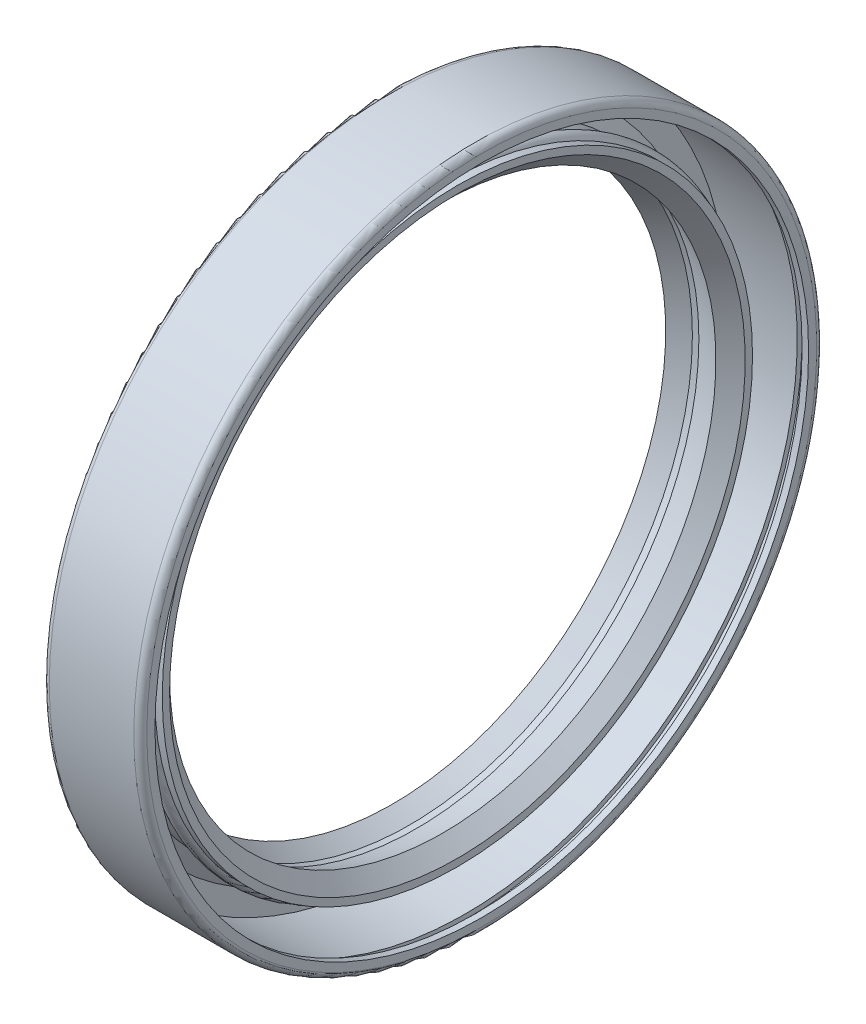
from build123d import *


with BuildPart() as part:
    # Esquisse1 → Base-Révolution (revolve)
    with BuildSketch(Plane(origin=(0, 0, 0), x_dir=(1, 0, 0), z_dir=(0, 1, 0)), mode=Mode.PRIVATE) as base_r_volution_sk:
        with BuildLine():
            Line((0, 15.683012702), (0, 17.166666667))
            ThreePointArc((0, 17.166666667), (0.097631073, 17.402368927), (0.333333333, 17.5))
            Line((0.333333333, 17.5), (4.666666667, 17.5))
            ThreePointArc((4.666666667, 17.5), (4.902368927, 17.402368927), (5, 17.166666667))
            Line((5, 17.166666667), (5, 16.75))
            Line((5, 16.75), (4.666666667, 16.75))
            Line((4.666666667, 16.75), (4.666666667, 17.25))
            Line((4.666666667, 17.25), (4.166666667, 17.25))
            Line((4.166666667, 17.25), (4.166666667, 17))
            Line((4.166666667, 17), (0.5, 17))
            Line((0.5, 17), (0.5, 15.816987298))
            Line((0.5, 15.816987298), (0.971687836, 15))
            Line((0.971687836, 15), (2.625, 15))
            ThreePointArc((2.625, 15), (2.936586758, 15.36959946), (3.353553391, 15.125))
            Line((3.353553391, 15.125), (3.75, 15.125))
            Line((3.75, 15.125), (3.75, 14.75))
            Line((3.75, 14.75), (3, 14))
            Line((3, 14), (1.62626129, 14.5))
            Line((1.62626129, 14.5), (1.293589427, 14.5))
            Line((1.293589427, 14.5), (0.427564023, 14))
            Line((0.427564023, 14), (0.25, 14.30754991))
            Line((0.25, 14.30754991), (0.583333333, 14.5))
            Line((0.583333333, 14.5), (0.333333333, 14.5))
            ThreePointArc((0.333333333, 14.5), (0.097631073, 14.597631073), (0, 14.833333333))
            Line((0, 14.833333333), (0, 15.25))
            Line((0, 15.25), (0.25, 15.25))
            Line((0.25, 15.25), (0, 15.683012702))
        make_face()
    revolve(base_r_volution_sk.sketch.rotate(Axis((0, 0, 0), (1, 0, 0)), 180), axis=Axis((0, 0, 0), (1, 0, 0)))


solid = part.part
